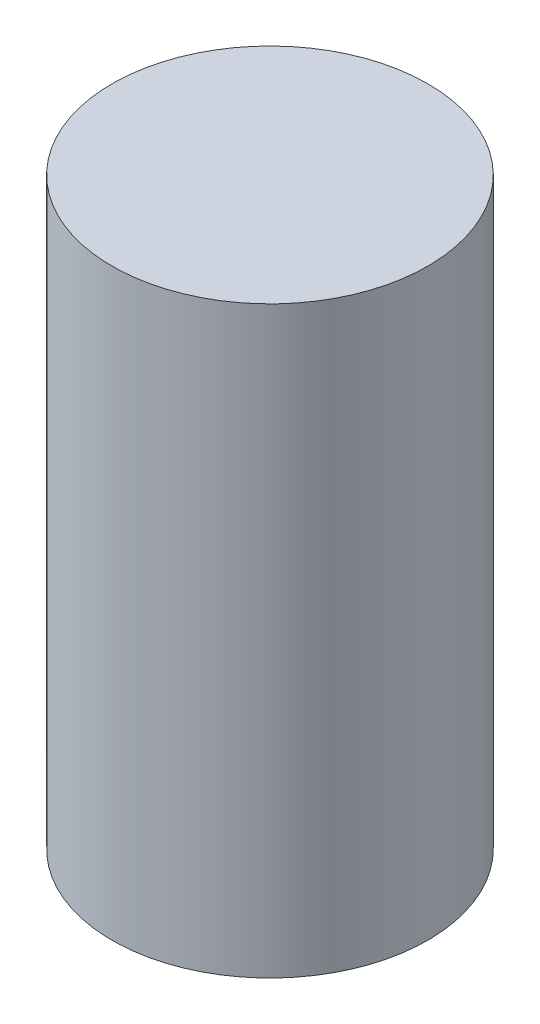
from build123d import *

# Parameters (mm, degrees)
SKETCH1_R           = 33
BOSS_EXTRUDE1_DEPTH = 122


with BuildPart() as part:
    # Sketch1 → Boss-Extrude1 (new body)
    with BuildSketch(Plane(origin=(0, 0, 0), x_dir=(1, 0, 0), z_dir=(0, 1, 0))):
        with Locations(Location((0, 0, 0), (0, 0, 90))):
            Circle(SKETCH1_R)
    extrude(amount=BOSS_EXTRUDE1_DEPTH)


solid = part.part
